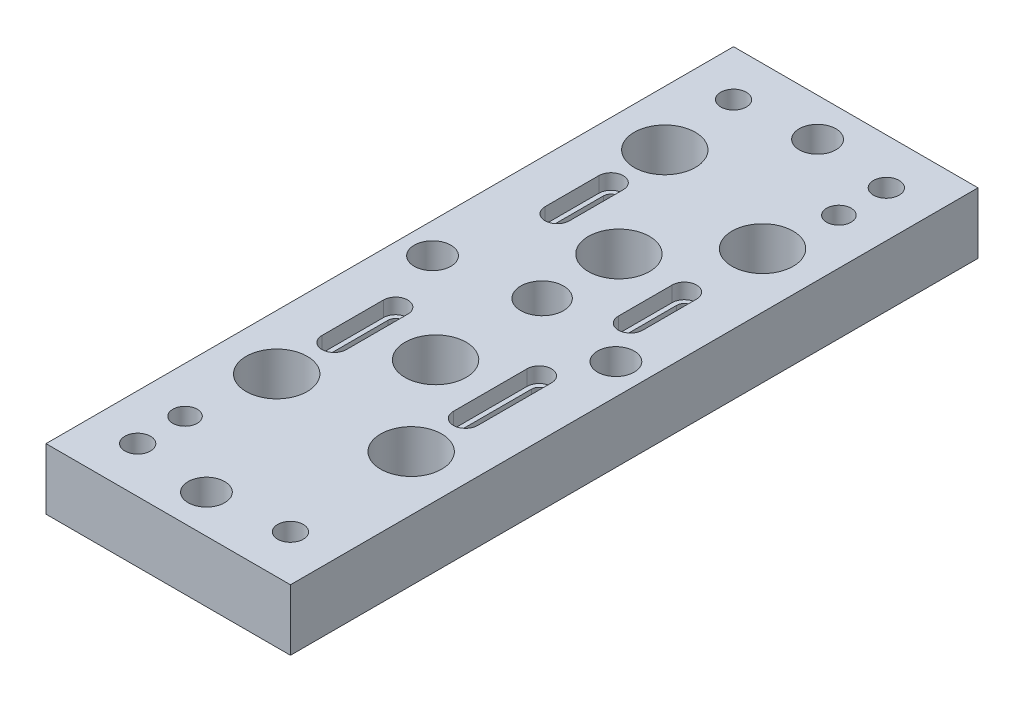
from build123d import *

# Parameters (mm, degrees)
SKETCH1_W                                    = 80
SKETCH1_H                                    = 225
BOSS_EXTRUDE1_DEPTH                          = 20
CUT_EXTRUDE1_REACH                           = 123.063
CUT_EXTRUDE2_DEPTH                           = 5
CBORE_FOR_M8_HEX_SOCKET_HEAD_CAP_SCR_2_COUNT = 2
CBORE_FOR_M8_HEX_SOCKET_HEAD_CAP_SCR_2_PITCH = 50
CBORE_FOR_M8_HEX_SOCKET_HEAD_CAP_SCR_3_COUNT = 2
CBORE_FOR_M8_HEX_SOCKET_HEAD_CAP_SCR_3_PITCH = 201.308221392
CBORE_FOR_M8_HEX_SOCKET_HEAD_CAP_SCR_4_COUNT = 2
CBORE_FOR_M8_HEX_SOCKET_HEAD_CAP_SCR_4_PITCH = 195
F_8_0MM_DOWEL_HOLE1_D                        = 8
SKETCH11_R                                   = 10
CUT_EXTRUDE3_DEPTH                           = 122.063000128
CUT_EXTRUDE4_REACH                           = 123.063
SKETCH13_R                                   = 6
CUT_EXTRUDE5_REACH                           = 123.063
SKETCH14_R                                   = 7


with BuildPart() as part:
    # Sketch1 → Boss-Extrude1 (new body)
    with BuildSketch(Plane(origin=(0, 0, 0), x_dir=(1, 0, 0), z_dir=(0, 1, 0))):
        Rectangle(SKETCH1_W, SKETCH1_H)
    extrude(amount=-BOSS_EXTRUDE1_DEPTH)

    # Sketch2 → Cut-Extrude1 (cut, up to next)
    with BuildSketch(Plane(origin=(0, 0, 0), x_dir=(1, 0, 0), z_dir=(0, 1, 0)), mode=Mode.PRIVATE) as cut_extrude1_sk1:
        with BuildLine():
            Line((24, 17.31), (24, 34.91))
            ThreePointArc((24, 34.91), (21.5, 37.41), (19, 34.91))
            Line((19, 34.91), (19, 17.31))
            ThreePointArc((19, 17.31), (21.5, 14.81), (24, 17.31))
        make_face()
    cut_extrude1_tool1 = extrude(cut_extrude1_sk1.sketch, amount=-CUT_EXTRUDE1_REACH, mode=Mode.PRIVATE) & part.part
    # Sketch2 → Cut-Extrude1 (cut, up to next)
    with BuildSketch(Plane(origin=(0, 0, 0), x_dir=(1, 0, 0), z_dir=(0, 1, 0)), mode=Mode.PRIVATE) as cut_extrude1_sk2:
        with BuildLine():
            Line((24, -36.69), (24, -12.59))
            ThreePointArc((24, -12.59), (21.5, -10.09), (19, -12.59))
            Line((19, -12.59), (19, -36.69))
            ThreePointArc((19, -36.69), (21.5, -39.19), (24, -36.69))
        make_face()
    cut_extrude1_tool2 = extrude(cut_extrude1_sk2.sketch, amount=-CUT_EXTRUDE1_REACH, mode=Mode.PRIVATE) & part.part
    # Sketch2 → Cut-Extrude1 (cut, up to next)
    with BuildSketch(Plane(origin=(0, 0, 0), x_dir=(1, 0, 0), z_dir=(0, 1, 0)), mode=Mode.PRIVATE) as cut_extrude1_sk3:
        with BuildLine():
            Line((-24, -16.59), (-24, -36.69))
            ThreePointArc((-24, -36.69), (-21.5, -39.19), (-19, -36.69))
            Line((-19, -36.69), (-19, -16.59))
            ThreePointArc((-19, -16.59), (-21.5, -14.09), (-24, -16.59))
        make_face()
    cut_extrude1_tool3 = extrude(cut_extrude1_sk3.sketch, amount=-CUT_EXTRUDE1_REACH, mode=Mode.PRIVATE) & part.part
    # Sketch2 → Cut-Extrude1 (cut, up to next)
    with BuildSketch(Plane(origin=(0, 0, 0), x_dir=(1, 0, 0), z_dir=(0, 1, 0)), mode=Mode.PRIVATE) as cut_extrude1_sk4:
        with BuildLine():
            Line((-24, 53.91), (-24, 36.31))
            ThreePointArc((-24, 36.31), (-21.5, 33.81), (-19, 36.31))
            Line((-19, 36.31), (-19, 53.91))
            ThreePointArc((-19, 53.91), (-21.5, 56.41), (-24, 53.91))
        make_face()
    cut_extrude1_tool4 = extrude(cut_extrude1_sk4.sketch, amount=-CUT_EXTRUDE1_REACH, mode=Mode.PRIVATE) & part.part
    add(cut_extrude1_tool1.solids().sort_by_distance((21.5, 0, -26.11))[0], mode=Mode.SUBTRACT)
    add(cut_extrude1_tool2.solids().sort_by_distance((21.5, 0, 24.64))[0], mode=Mode.SUBTRACT)
    add(cut_extrude1_tool3.solids().sort_by_distance((-21.5, 0, 26.64))[0], mode=Mode.SUBTRACT)
    add(cut_extrude1_tool4.solids().sort_by_distance((-21.5, 0, -45.11))[0], mode=Mode.SUBTRACT)

    # Sketch3 → Cut-Extrude2 (cut)
    with BuildSketch(Plane(origin=(0, 0, 0), x_dir=(1, 0, 0), z_dir=(0, 1, 0))):
        with BuildLine():
            Line((-17.5, 36.31), (-17.5, 53.91))
            ThreePointArc((-17.5, 53.91), (-21.5, 57.91), (-25.5, 53.91))
            Line((-25.5, 53.91), (-25.5, 36.31))
            ThreePointArc((-25.5, 36.31), (-21.5, 32.31), (-17.5, 36.31))
        make_face()
        with BuildLine():
            Line((25.5, 17.31), (25.5, 34.91))
            ThreePointArc((25.5, 34.91), (21.5, 38.91), (17.5, 34.91))
            Line((17.5, 34.91), (17.5, 17.31))
            ThreePointArc((17.5, 17.31), (21.5, 13.31), (25.5, 17.31))
        make_face()
        with BuildLine():
            Line((25.5, -36.69), (25.5, -12.59))
            ThreePointArc((25.5, -12.59), (21.5, -8.59), (17.5, -12.59))
            Line((17.5, -12.59), (17.5, -36.69))
            ThreePointArc((17.5, -36.69), (21.5, -40.69), (25.5, -36.69))
        make_face()
        with BuildLine():
            Line((-25.5, -16.59), (-25.5, -36.69))
            ThreePointArc((-25.5, -36.69), (-21.5, -40.69), (-17.5, -36.69))
            Line((-17.5, -36.69), (-17.5, -16.59))
            ThreePointArc((-17.5, -16.59), (-21.5, -12.59), (-25.5, -16.59))
        make_face()
    extrude(amount=-CUT_EXTRUDE2_DEPTH, mode=Mode.SUBTRACT)

    # Sketch6 → CBORE for M8 Hex Socket Head Cap Screw1 (revolve, cut)
    with BuildSketch(Plane(origin=(25, -20, -97.5), x_dir=(0, 0, -1), z_dir=(1, 0, 0))):
        Polygon((0, 0), (0, 20), (4.2, 20), (4.2, 8.6), (7.5, 8.6), (7.5, 0.025), (7.525, 0), align=None)
    cbore_for_m8_hex_socket_head_cap_screw1 = revolve(axis=Axis((25, -26.35, -97.5), (0, 1, 0)), mode=Mode.SUBTRACT)

    # CBORE for M8 Hex Socket Head Cap Scr 2: CBORE for M8 Hex Socket Head Cap Screw1 ×2
    with Locations(*[(-i * CBORE_FOR_M8_HEX_SOCKET_HEAD_CAP_SCR_2_PITCH, 0, 0) for i in range(1, CBORE_FOR_M8_HEX_SOCKET_HEAD_CAP_SCR_2_COUNT)]):
        add(cbore_for_m8_hex_socket_head_cap_screw1, mode=Mode.SUBTRACT)

    # CBORE for M8 Hex Socket Head Cap Scr 3: CBORE for M8 Hex Socket Head Cap Screw1 ×2
    with Locations(*[Vector(-0.24837535026770385, 0, 0.968663866044045) * (i * CBORE_FOR_M8_HEX_SOCKET_HEAD_CAP_SCR_3_PITCH) for i in range(1, CBORE_FOR_M8_HEX_SOCKET_HEAD_CAP_SCR_3_COUNT)]):
        add(cbore_for_m8_hex_socket_head_cap_screw1, mode=Mode.SUBTRACT)

    # CBORE for M8 Hex Socket Head Cap Scr 4: CBORE for M8 Hex Socket Head Cap Screw1 ×2
    with Locations(*[(0, 0, i * CBORE_FOR_M8_HEX_SOCKET_HEAD_CAP_SCR_4_PITCH) for i in range(1, CBORE_FOR_M8_HEX_SOCKET_HEAD_CAP_SCR_4_COUNT)]):
        add(cbore_for_m8_hex_socket_head_cap_screw1, mode=Mode.SUBTRACT)

    # Ø8.0mm Dowel Hole1 (through all)
    with Locations(Plane(origin=(0, -20, 0), x_dir=(-1, 0, 0), z_dir=(0, -1, 0))):
        with Locations((-25, 81.975), (25, -82)):
            Hole(F_8_0MM_DOWEL_HOLE1_D / 2)

    # Sketch11 → Cut-Extrude3 (cut, through all)
    with BuildSketch(Plane.XZ.offset(20)):
        with Locations(Location((-22, 55, 0), (0, 0, 270))):
            Circle(SKETCH11_R)
        with Locations(Location((22, 55, 0), (0, 0, 270))):
            Circle(SKETCH11_R)
        with Locations(Location((-22, -72, 0), (0, 0, 270))):
            Circle(SKETCH11_R)
        with Locations(Location((22, -60, 0), (0, 0, 270))):
            Circle(SKETCH11_R)
        with Locations(Location((0, -35, 0), (0, 0, 270))):
            Circle(SKETCH11_R)
        with Locations(Location((0, 25, 0), (0, 0, 270))):
            Circle(SKETCH11_R)
    extrude(amount=-CUT_EXTRUDE3_DEPTH, mode=Mode.SUBTRACT)

    # Sketch13 → Cut-Extrude4 (cut, up to next)
    with BuildSketch(Plane(origin=(0, 0, 0), x_dir=(1, 0, 0), z_dir=(0, 1, 0)), mode=Mode.PRIVATE) as cut_extrude4_sk1:
        with Locations(Location((0, 100, 0), (0, 0, 270))):
            Circle(SKETCH13_R)
    cut_extrude4_tool1 = extrude(cut_extrude4_sk1.sketch, amount=-CUT_EXTRUDE4_REACH, mode=Mode.PRIVATE) & part.part
    # Sketch13 → Cut-Extrude4 (cut, up to next)
    with BuildSketch(Plane(origin=(0, 0, 0), x_dir=(1, 0, 0), z_dir=(0, 1, 0)), mode=Mode.PRIVATE) as cut_extrude4_sk2:
        with Locations(Location((0, -100, 0), (0, 0, 270))):
            Circle(SKETCH13_R)
    cut_extrude4_tool2 = extrude(cut_extrude4_sk2.sketch, amount=-CUT_EXTRUDE4_REACH, mode=Mode.PRIVATE) & part.part
    # Sketch13 → Cut-Extrude4 (cut, up to next)
    with BuildSketch(Plane(origin=(0, 0, 0), x_dir=(1, 0, 0), z_dir=(0, 1, 0)), mode=Mode.PRIVATE) as cut_extrude4_sk3:
        with Locations(Location((-30, 4, 0), (0, 0, 270))):
            Circle(SKETCH13_R)
    cut_extrude4_tool3 = extrude(cut_extrude4_sk3.sketch, amount=-CUT_EXTRUDE4_REACH, mode=Mode.PRIVATE) & part.part
    # Sketch13 → Cut-Extrude4 (cut, up to next)
    with BuildSketch(Plane(origin=(0, 0, 0), x_dir=(1, 0, 0), z_dir=(0, 1, 0)), mode=Mode.PRIVATE) as cut_extrude4_sk4:
        with Locations(Location((30, 4, 0), (0, 0, 270))):
            Circle(SKETCH13_R)
    cut_extrude4_tool4 = extrude(cut_extrude4_sk4.sketch, amount=-CUT_EXTRUDE4_REACH, mode=Mode.PRIVATE) & part.part
    add(cut_extrude4_tool1.solids().sort_by_distance((0, 0, -100))[0], mode=Mode.SUBTRACT)
    add(cut_extrude4_tool2.solids().sort_by_distance((0, 0, 100))[0], mode=Mode.SUBTRACT)
    add(cut_extrude4_tool3.solids().sort_by_distance((-30, 0, -4))[0], mode=Mode.SUBTRACT)
    add(cut_extrude4_tool4.solids().sort_by_distance((30, 0, -4))[0], mode=Mode.SUBTRACT)

    # Sketch14 → Cut-Extrude5 (cut, up to next)
    with BuildSketch(Plane(origin=(0, 0, 0), x_dir=(1, 0, 0), z_dir=(0, 1, 0)), mode=Mode.PRIVATE) as cut_extrude5_sk1:
        with Locations(Location((0, 9.86, 0), (0, 0, 270))):
            Circle(SKETCH14_R)
    cut_extrude5_tool1 = extrude(cut_extrude5_sk1.sketch, amount=-CUT_EXTRUDE5_REACH, mode=Mode.PRIVATE) & part.part
    add(cut_extrude5_tool1.solids().sort_by_distance((0, 0, -9.86))[0], mode=Mode.SUBTRACT)


solid = part.part
